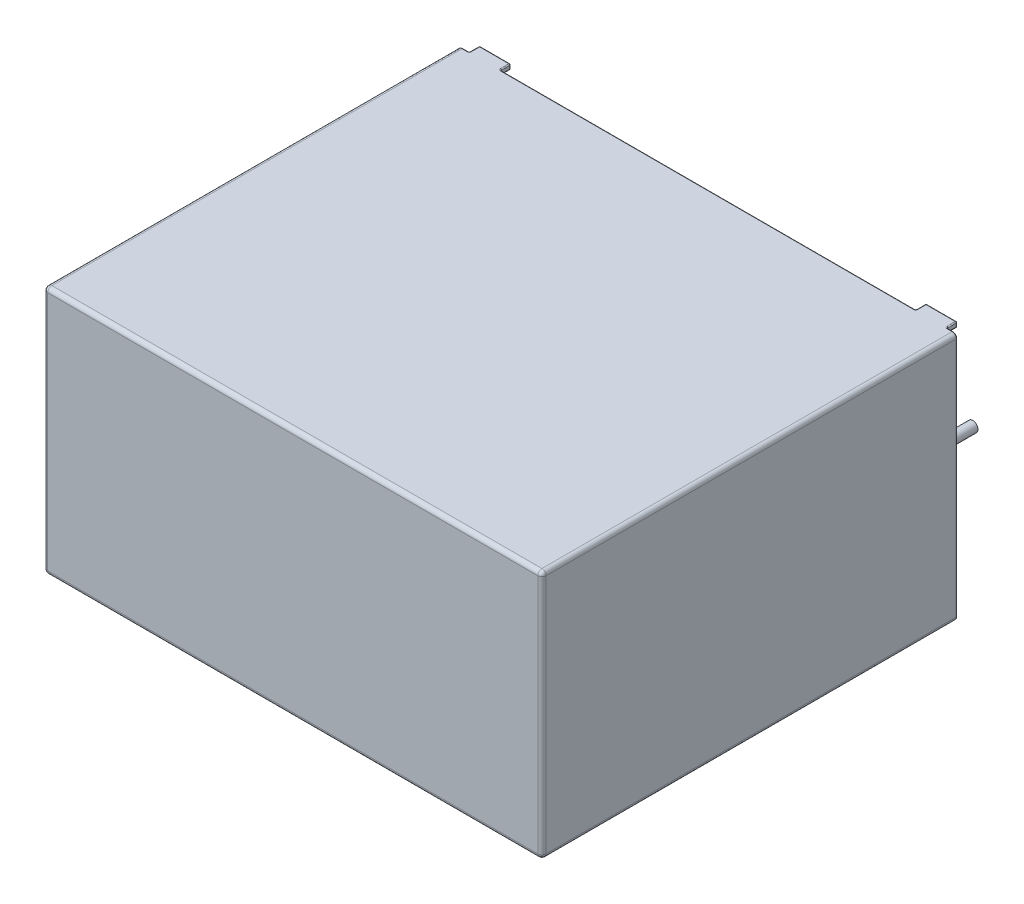
from build123d import *

# Parameters (mm, degrees)
BASIS_LINEAR_AUSTRAGEN_DEPTH    = 20.5
CUT_EXTRUDE1_DEPTH              = 0.7
FILLET1_R                       = 0.05
VERRUNDUNG1_R                   = 0.2
SKETCH4_W                       = 20
SKETCH4_H                       = 0.5
SKETCH4_W_2                     = 0.5
CUT_EXTRUDE2_DEPTH              = 30
SKIZZE2_R                       = 0.25
AUFSATZ_LINEAR_AUSTRAGEN1_DEPTH = 2.7
FILLET2_R                       = 0.05
FILLET6_R                       = 0.1
SKIZZE3_W                       = 0.211538461
SKIZZE3_H                       = 1.5
BOSS_EXTRUDE1_DEPTH             = 0.05


with BuildPart() as part:
    # Skizze1 → Basis-Linear austragen (new body)
    with BuildSketch(Plane(origin=(0, 0, 0), x_dir=(1, 0, 0), z_dir=(0, 0, -1))):
        with BuildLine():
            Line((-11.8, -6), (11.8, -6))
            ThreePointArc((11.8, -6), (11.941421356, -5.941421356), (12, -5.8))
            Line((12, -5.8), (12, 5.8))
            ThreePointArc((12, 5.8), (11.941421356, 5.941421356), (11.8, 6))
            Line((11.8, 6), (-11.8, 6))
            ThreePointArc((-11.8, 6), (-11.941421356, 5.941421356), (-12, 5.8))
            Line((-12, 5.8), (-12, -5.8))
            ThreePointArc((-12, -5.8), (-11.941421356, -5.941421356), (-11.8, -6))
        make_face()
    extrude(amount=-BASIS_LINEAR_AUSTRAGEN_DEPTH)

    # Sketch3 → Cut-Extrude1 (cut)
    with BuildSketch(Plane(origin=(0, 0, 0), x_dir=(-1, 0, 0), z_dir=(0, 0, -1))):
        with BuildLine():
            Line((-11.625, 5.75), (11.625, 5.75))
            ThreePointArc((11.625, 5.75), (11.713388348, 5.713388348), (11.75, 5.625))
            Line((11.75, 5.625), (11.75, -5.625))
            ThreePointArc((11.75, -5.625), (11.713388348, -5.713388348), (11.625, -5.75))
            Line((11.625, -5.75), (-11.625, -5.75))
            ThreePointArc((-11.625, -5.75), (-11.713388348, -5.713388348), (-11.75, -5.625))
            Line((-11.75, -5.625), (-11.75, 5.625))
            ThreePointArc((-11.75, 5.625), (-11.713388348, 5.713388348), (-11.625, 5.75))
        make_face()
    extrude(amount=-CUT_EXTRUDE1_DEPTH, mode=Mode.SUBTRACT)

    # Fillet1
    fillet1_edges = [part.edges().sort_by_distance(p)[0] for p in [
        (-11.713388348, 5.713388348, 0.7),
        (-11.75, 0, 0.7),
        (-11.713388348, -5.713388348, 0.7),
        (0, -5.75, 0.7),
        (11.713388348, -5.713388348, 0.7),
        (11.75, 0, 0.7),
        (11.713388348, 5.713388348, 0.7),
        (0, 5.75, 0.7),
    ]]
    fillet(fillet1_edges, radius=FILLET1_R)

    # Verrundung1
    verrundung1_edges = [part.edges().sort_by_distance(p)[0] for p in [
        (11.941421356, 5.941421356, 20.5),
        (12, 0, 20.5),
        (11.941421356, -5.941421356, 20.5),
        (0, -6, 20.5),
        (-11.941421356, -5.941421356, 20.5),
        (-12, 0, 20.5),
        (-11.941421356, 5.941421356, 20.5),
        (0, 6, 20.5),
    ]]
    fillet(verrundung1_edges, radius=VERRUNDUNG1_R)

    # Sketch4 → Cut-Extrude2 (cut)
    with BuildSketch(Plane(origin=(0, 6, 0), x_dir=(1, 0, 0), z_dir=(0, 1, 0))):
        with Locations((0, -0.25)):
            Rectangle(SKETCH4_W, SKETCH4_H)
        with Locations((11.75, -0.25)):
            Rectangle(SKETCH4_W_2, SKETCH4_H)
        with Locations((-11.75, -0.25)):
            Rectangle(SKETCH4_W_2, SKETCH4_H)
    extrude(amount=-CUT_EXTRUDE2_DEPTH, mode=Mode.SUBTRACT)

    # Skizze2 → Aufsatz-Linear austragen1 (add)
    with BuildSketch(Plane(origin=(0, 0, 0.7), x_dir=(-1, 0, 0), z_dir=(0, 0, -1))):
        with Locations(Location((-10.25, 0, 0), (0, 0, 270))):
            Circle(SKIZZE2_R)
        with Locations(Location((10.25, 0, 0), (0, 0, 180))):
            Circle(SKIZZE2_R)
    extrude(amount=AUFSATZ_LINEAR_AUSTRAGEN1_DEPTH)

    # Fillet2
    fillet2_edges = [part.edges().sort_by_distance(p)[0] for p in [
        (10.75, -5.75, 0),
        (-10.75, -5.75, 0),
        (-10.75, 6, 0),
        (10.75, 6, 0),
        (10.75, -6, 0),
        (-10.75, -6, 0),
        (-12, 0, 0.5),
        (-11.5, -6, 0.25),
        (-11.5, -5.875, 0),
        (-11.5, -5.75, 0.25),
        (-11.5, 5.875, 0),
        (-11.941421356, 5.941421356, 0.5),
        (-11.65, -6, 0.5),
        (-11.941421356, -5.941421356, 0.5),
        (-11.5, -5.875, 0.5),
        (-11.5625, -5.75, 0.5),
        (-11.713388348, -5.713388348, 0.5),
        (-11.75, 0, 0.5),
        (-11.713388348, 5.713388348, 0.5),
        (-11.5, 5.875, 0.5),
        (-11.65, 6, 0.5),
        (-11.5, 6, 0.25),
        (11.5, -5.875, 0),
        (11.5, 5.875, 0),
        (11.941421356, -5.941421356, 0.5),
        (11.65, -6, 0.5),
        (11.941421356, 5.941421356, 0.5),
        (12, 0, 0.5),
        (11.713388348, 5.713388348, 0.5),
        (11.75, 0, 0.5),
        (11.713388348, -5.713388348, 0.5),
        (11.5625, -5.75, 0.5),
        (11.5, -6, 0.25),
        (11.5, -5.875, 0.5),
        (11.5, -5.75, 0.25),
        (11.5, 5.875, 0.5),
        (11.5, 6, 0.25),
        (11.65, 6, 0.5),
        (-10, -6, 0.25),
        (-10, -5.875, 0.5),
        (-10, -5.75, 0.25),
        (-10, 5.875, 0.5),
        (-10, -5.875, 0),
        (-10, 5.875, 0),
        (10, -6, 0.25),
        (10, -5.875, 0),
        (10, -5.75, 0.25),
        (10, 5.875, 0),
        (0, -6, 0.5),
        (10, -5.875, 0.5),
        (0, -5.75, 0.5),
        (10, 5.875, 0.5),
        (-10, 6, 0.25),
        (0, 6, 0.5),
        (10, 6, 0.25),
        (-10.75, 5.75, 0),
        (10.75, 5.75, 0),
        (0, 5.75, 0.5),
        (10, 5.75, 0.25),
        (-10, 5.75, 0.25),
        (11.5, 5.75, 0.25),
        (11.5625, 5.75, 0.5),
        (-11.5625, 5.75, 0.5),
        (-11.5, 5.75, 0.25),
    ]]
    fillet(fillet2_edges, radius=FILLET2_R)

    # Fillet6
    fillet6_edges = [part.edges().sort_by_distance(p)[0] for p in [
        (10.25, 0.25, 0.7),
        (-10.5, 0, 0.7),
    ]]
    fillet(fillet6_edges, radius=FILLET6_R)

    # Skizze3 → Boss-Extrude1 (add)
    # profile 1 of 4: a face of its own
    with BuildSketch(Plane(origin=(0, -6, 0), x_dir=(1, 0, 0), z_dir=(0, 1, 0))):
        with BuildLine():
            Line((-2.44921875, -17.5), (-2.826923077, -19))
            Line((-2.826923077, -19), (-2.608473558, -19))
            Line((-2.608473558, -19), (-2.385817308, -18.013521635))
            add(Edge.make_bspline(
                [(-2.385817308, -18.013521635), (-2.374277876, -17.962644961), (-2.351316821, -17.861411022), (-2.328605226, -17.760120826), (-2.317307692, -17.709735577)],
                knots=[0, 0, 0, 0, 1.00513078, 2, 2, 2, 2], degree=3))
            add(Edge.make_bspline(
                [(-2.317307692, -17.709735577), (-2.311958665, -17.727852865), (-2.301860675, -17.762055005), (-2.288210151, -17.810539833), (-2.275811816, -17.852856044), (-2.265249072, -17.889200907), (-2.256696459, -17.919625487), (-2.24931223, -17.943755926), (-2.244279231, -17.962064779), (-2.241296667, -17.97215851), (-2.240084135, -17.976262019)],
                knots=[0, 0, 0, 0, 1.633809233, 3.084334118, 4.356383392, 5.447555203, 6.357852567, 7.089694452, 7.629924063, 8, 8, 8, 8], degree=3))
            Line((-2.240084135, -17.976262019), (-1.943810096, -19))
            Line((-1.943810096, -19), (-1.689302885, -19))
            Line((-1.689302885, -19), (-1.475060096, -18.248497596))
            add(Edge.make_bspline(
                [(-1.475060096, -18.248497596), (-1.463236878, -18.202072725), (-1.439924049, -18.110532926), (-1.408949194, -17.974181006), (-1.380360393, -17.84113701), (-1.363892706, -17.753142892), (-1.355769231, -17.709735577)],
                knots=[0, 0, 0, 0, 1.04154457, 2.053700482, 3.039894486, 4, 4, 4, 4], degree=3))
            add(Edge.make_bspline(
                [(-1.355769231, -17.709735577), (-1.350741876, -17.731866642), (-1.340121657, -17.778618224), (-1.323789638, -17.852402478), (-1.305253486, -17.933362952), (-1.292641937, -17.989777717), (-1.286057692, -18.019230769)],
                knots=[0, 0, 0, 0, 0.858436457, 1.813435672, 2.858437265, 4, 4, 4, 4], degree=3))
            Line((-1.286057692, -18.019230769), (-1.064603365, -19))
            Line((-1.064603365, -19), (-0.846153846, -19))
            Line((-0.846153846, -19), (-1.224158654, -17.5))
            Line((-1.224158654, -17.5), (-1.456730769, -17.5))
            Line((-1.456730769, -17.5), (-1.770132212, -18.646334135))
            add(Edge.make_bspline(
                [(-1.770132212, -18.646334135), (-1.773279213, -18.657540616), (-1.779257345, -18.678828758), (-1.787093276, -18.709207658), (-1.794863932, -18.735924651), (-1.801044723, -18.75932501), (-1.806393679, -18.779172932), (-1.811130409, -18.795410305), (-1.814176947, -18.808354922), (-1.816380061, -18.815712257), (-1.817307692, -18.818810096)],
                knots=[0, 0, 0, 0, 1.562239628, 2.967673567, 4.210417925, 5.296319877, 6.215971374, 6.969386481, 7.566055473, 8, 8, 8, 8], degree=3))
            add(Edge.make_bspline(
                [(-1.817307692, -18.818810096), (-1.822884287, -18.799169336), (-1.833447569, -18.76196547), (-1.848831258, -18.709656659), (-1.862057373, -18.663755658), (-1.870288199, -18.63541543), (-1.874098558, -18.622295673)],
                knots=[0, 0, 0, 0, 1.197732026, 2.268764715, 3.198546125, 4, 4, 4, 4], degree=3))
            Line((-1.874098558, -18.622295673), (-2.198918269, -17.5))
            Line((-2.198918269, -17.5), (-2.44921875, -17.5))
        make_face()
    # profile 2 of 4: a face of its own
    with BuildSketch(Plane(origin=(0, -6, 0), x_dir=(1, 0, 0), z_dir=(0, 1, 0))):
        with Locations((-0.586538461, -18.25)):
            Rectangle(SKIZZE3_W, SKIZZE3_H)
    # profile 3 of 4: a face of its own
    with BuildSketch(Plane(origin=(0, -6, 0), x_dir=(1, 0, 0), z_dir=(0, 1, 0))):
        with BuildLine():
            Line((-0.173076923, -17.5), (-0.173076923, -19))
            Line((-0.173076923, -19), (0.145132212, -19))
            Line((0.145132212, -19), (0.48046875, -17.947415865))
            add(Edge.make_bspline(
                [(0.48046875, -17.947415865), (0.484159143, -17.935491922), (0.491296148, -17.912431708), (0.501879479, -17.879130638), (0.511508537, -17.848184758), (0.52018102, -17.819495566), (0.528365353, -17.793205501), (0.535451697, -17.769098835), (0.542226472, -17.747443447), (0.546196793, -17.733680739), (0.548076923, -17.727163462)],
                knots=[0, 0, 0, 0, 1.300204174, 2.514519184, 3.639827924, 4.676153899, 5.636536826, 6.507959918, 7.293450077, 8, 8, 8, 8], degree=3))
            add(Edge.make_bspline(
                [(0.548076923, -17.727163462), (0.550170952, -17.73427764), (0.554627179, -17.749417068), (0.561851435, -17.773221222), (0.569538249, -17.799563197), (0.57873701, -17.827990218), (0.588325629, -17.858948215), (0.598390132, -17.892411478), (0.609999341, -17.928045917), (0.617714241, -17.952716187), (0.621694712, -17.965444712)],
                knots=[0, 0, 0, 0, 0.713638162, 1.518667645, 2.393860736, 3.354087503, 4.393659122, 5.512594909, 6.716633584, 8, 8, 8, 8], degree=3))
            Line((0.621694712, -17.965444712), (0.953725962, -19))
            Line((0.953725962, -19), (1.269230769, -19))
            Line((1.269230769, -19), (1.269230769, -17.5))
            Line((1.269230769, -17.5), (1.057692308, -17.5))
            Line((1.057692308, -17.5), (1.057692308, -18.769230769))
            Line((1.057692308, -18.769230769), (0.657451923, -17.5))
            Line((0.657451923, -17.5), (0.436298077, -17.5))
            Line((0.436298077, -17.5), (0.038461538, -18.769230769))
            Line((0.038461538, -18.769230769), (0.038461538, -17.5))
            Line((0.038461538, -17.5), (-0.173076923, -17.5))
        make_face()
    # profile 4 of 4: a face of its own
    with BuildSketch(Plane(origin=(0, -6, 0), x_dir=(1, 0, 0), z_dir=(0, 1, 0))):
        Polygon((1.390925481, -17.5), (1.986478365, -19), (2.225060096, -19), (2.820612981, -17.5), (2.596153846, -17.5), (2.425480769, -17.961538462), (1.786057692, -17.961538462), (1.615384615, -17.5), align=None)
        with BuildLine():
            Line((1.849759615, -18.134615385), (2.361778846, -18.134615385))
            Line((2.361778846, -18.134615385), (2.216045673, -18.528846154))
            add(Edge.make_bspline(
                [(2.216045673, -18.528846154), (2.210458784, -18.544078694), (2.19953536, -18.573861185), (2.183245244, -18.61713263), (2.168362856, -18.658224971), (2.153769453, -18.696549002), (2.140595727, -18.732661417), (2.128453167, -18.766318295), (2.116444277, -18.797285703), (2.109237573, -18.817293839), (2.105769231, -18.826923077)],
                knots=[0, 0, 0, 0, 1.225184869, 2.395467751, 3.491410812, 4.525364584, 5.492066482, 6.394148129, 7.227157926, 8, 8, 8, 8], degree=3))
            add(Edge.make_bspline(
                [(2.105769231, -18.826923077), (2.100017833, -18.80318315), (2.088468953, -18.755513076), (2.064594195, -18.685717842), (2.036834864, -18.616717323), (2.01453834, -18.572271659), (2.003305288, -18.549879808)],
                knots=[0, 0, 0, 0, 0.989154277, 1.986234384, 2.985459177, 4, 4, 4, 4], degree=3))
            Line((2.003305288, -18.549879808), (1.849759615, -18.134615385))
        make_face(mode=Mode.SUBTRACT)
    extrude(amount=-BOSS_EXTRUDE1_DEPTH)


solid = part.part
